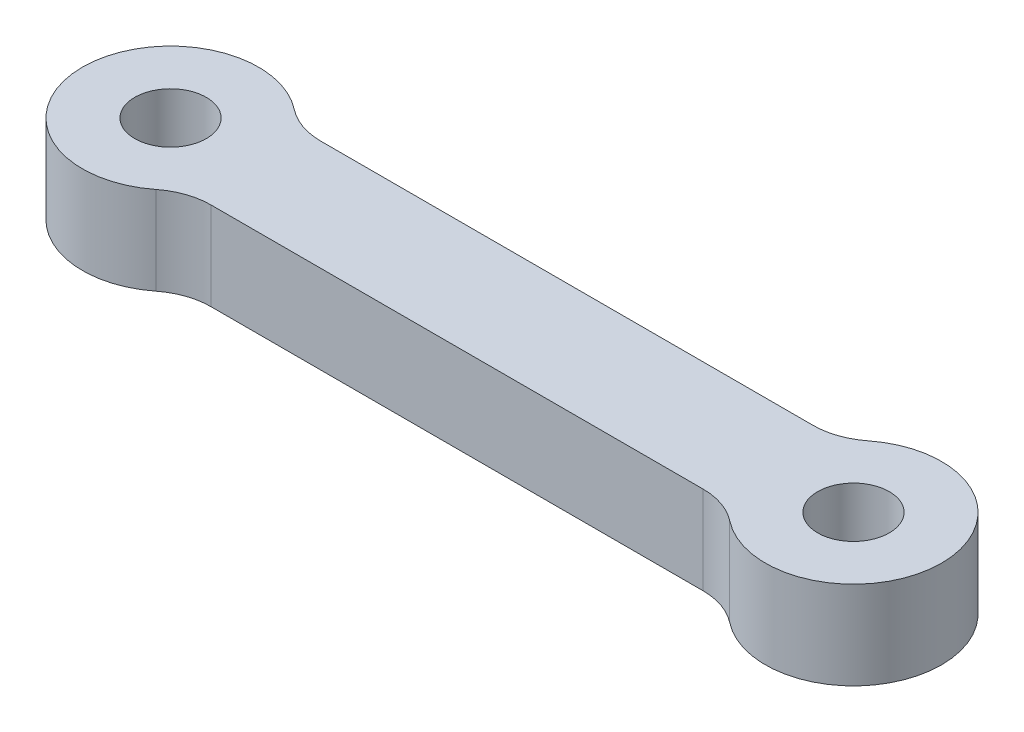
from build123d import *

# Parameters (mm, degrees)
SKETCH1_R           = 1.625
BOSS_EXTRUDE1_DEPTH = 4
FILLET1_R           = 3


with BuildPart() as part:
    # Sketch1 → Boss-Extrude1 (new body)
    with BuildSketch(Plane(origin=(0, 0, 0), x_dir=(1, 0, 0), z_dir=(0, 1, 0))):
        with BuildLine():
            ThreePointArc((3.122498999, 2.5), (-4, 0), (3.122498999, -2.5))
            Line((3.122498999, -2.5), (27.877501001, -2.5))
            ThreePointArc((27.877501001, -2.5), (35, 0), (27.877501001, 2.5))
            Line((27.877501001, 2.5), (3.122498999, 2.5))
        make_face()
        with Locations(Location((0, 0, 0), (0, 0, 270))):
            Circle(SKETCH1_R, mode=Mode.SUBTRACT)
        with Locations(Location((31, 0, 0), (0, 0, 270))):
            Circle(SKETCH1_R, mode=Mode.SUBTRACT)
    extrude(amount=BOSS_EXTRUDE1_DEPTH)

    # Fillet1
    fillet1_edges = [part.edges().sort_by_distance(p)[0] for p in [
        (27.877501001, 2, 2.5),
        (3.122498999, 2, 2.5),
        (3.122498999, 2, -2.5),
        (27.877501001, 2, -2.5),
    ]]
    fillet(fillet1_edges, radius=FILLET1_R)


solid = part.part
